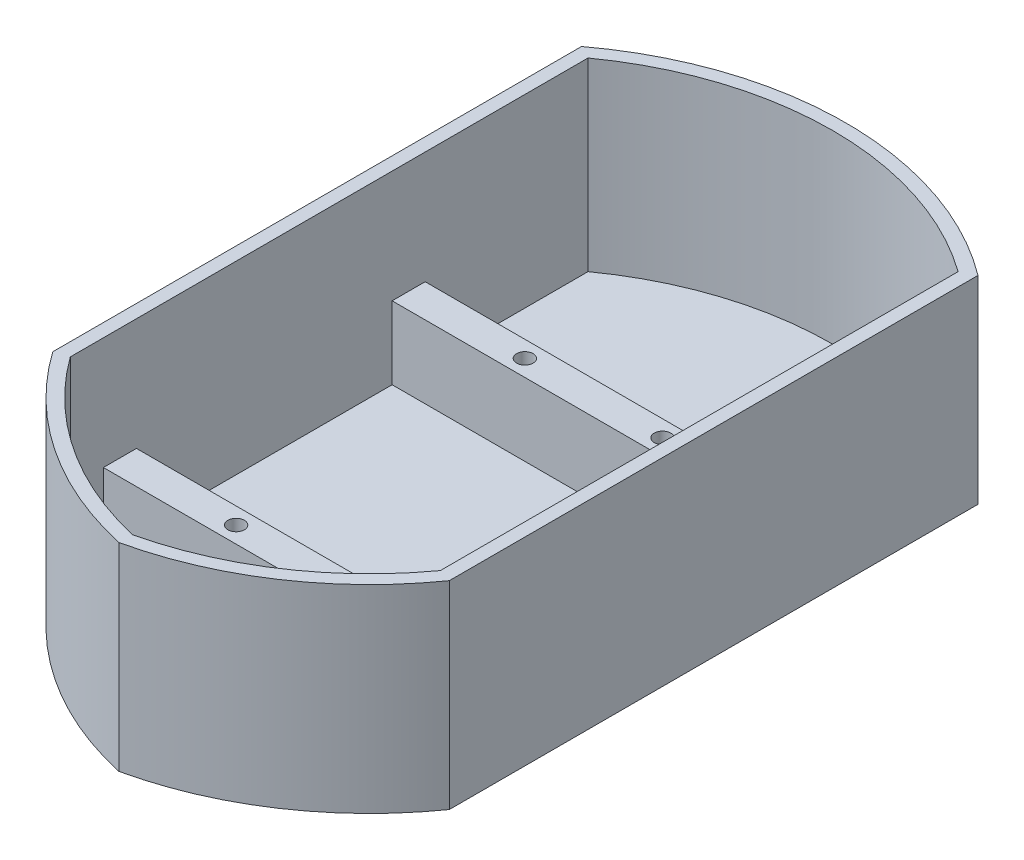
from build123d import *

# Parameters (mm, degrees)
SALIENTE_EXTRUIR1_DEPTH = 30
VACIADO1_T              = -2
CROQUIS2_W              = 56
CROQUIS2_H              = 5
CROQUIS2_R              = 1.25
SALIENTE_EXTRUIR2_DEPTH = 11


with BuildPart() as part:
    # Croquis1 → Saliente-Extruir1 (new body)
    with BuildSketch(Plane(origin=(0, 0, 0), x_dir=(1, 0, 0), z_dir=(0, 1, 0))):
        with BuildLine():
            Line((-30, 40), (-30, -40))
            ThreePointArc((-30, -40), (-16.865514856, -52.798272284), (0, -60))
            ThreePointArc((0, -60), (16.865514856, -52.798272284), (30, -40))
            Line((30, -40), (30, 40))
            ThreePointArc((30, 40), (15.811388301, 47.434164903), (0, 50))
            ThreePointArc((0, 50), (-15.811388301, 47.434164903), (-30, 40))
        make_face()
    extrude(amount=SALIENTE_EXTRUIR1_DEPTH)

    # Vaciado1
    vaciado1_openings = [part.faces().sort_by_distance(p)[0] for p in [
        (0, 30, 3.068322719),
    ]]
    offset(amount=VACIADO1_T, openings=vaciado1_openings, kind=Kind.INTERSECTION)

    # Croquis2 → Saliente-Extruir2 (add)
    # profile 1 of 2: a face of its own
    with BuildSketch(Plane(origin=(0, 2, 0), x_dir=(1, 0, 0), z_dir=(0, 1, 0))):
        with Locations((0, -31.845)):
            Rectangle(CROQUIS2_W, CROQUIS2_H)
        with Locations(Location((-10.415, -31.845, 0), (0, 0, 270))):
            Circle(CROQUIS2_R, mode=Mode.SUBTRACT)
        with Locations(Location((10.415, -31.845, 0), (0, 0, 270))):
            Circle(CROQUIS2_R, mode=Mode.SUBTRACT)
    # profile 2 of 2: a face of its own
    with BuildSketch(Plane(origin=(0, 2, 0), x_dir=(1, 0, 0), z_dir=(0, 1, 0))):
        with Locations((0, 11.845)):
            Rectangle(CROQUIS2_W, CROQUIS2_H)
        with Locations(Location((-10.415, 11.845, 0), (0, 0, 270))):
            Circle(CROQUIS2_R, mode=Mode.SUBTRACT)
        with Locations(Location((10.415, 11.845, 0), (0, 0, 270))):
            Circle(CROQUIS2_R, mode=Mode.SUBTRACT)
    extrude(amount=SALIENTE_EXTRUIR2_DEPTH)


solid = part.part
